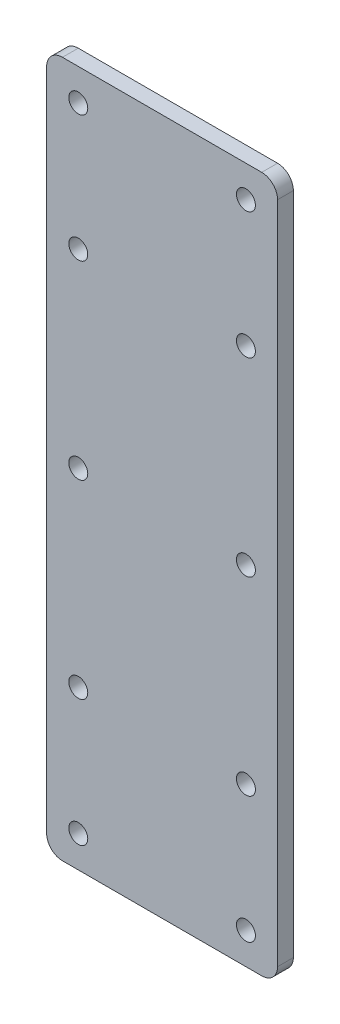
from build123d import *

# Parameters (mm, degrees)
SKETCH2_R           = 3
BOSS_EXTRUDE1_DEPTH = 5


with BuildPart() as part:
    # Sketch2 → Boss-Extrude1 (new body)
    with BuildSketch(Plane.XY):
        with BuildLine():
            Line((5, 0), (68, 0))
            ThreePointArc((68, 0), (71.535533906, 1.464466094), (73, 5))
            Line((73, 5), (73, 215))
            ThreePointArc((73, 215), (71.535533906, 218.535533906), (68, 220))
            Line((68, 220), (5, 220))
            ThreePointArc((5, 220), (1.464466094, 218.535533906), (0, 215))
            Line((0, 215), (0, 5))
            ThreePointArc((0, 5), (1.464466094, 1.464466094), (5, 0))
        make_face()
        with Locations((10, 210)):
            Circle(SKETCH2_R, mode=Mode.SUBTRACT)
        with Locations((63, 210)):
            Circle(SKETCH2_R, mode=Mode.SUBTRACT)
        with Locations((63, 170)):
            Circle(SKETCH2_R, mode=Mode.SUBTRACT)
        with Locations((10, 170)):
            Circle(SKETCH2_R, mode=Mode.SUBTRACT)
        with Locations((63, 50)):
            Circle(SKETCH2_R, mode=Mode.SUBTRACT)
        with Locations((10, 50)):
            Circle(SKETCH2_R, mode=Mode.SUBTRACT)
        with Locations((10, 10)):
            Circle(SKETCH2_R, mode=Mode.SUBTRACT)
        with Locations((63, 10)):
            Circle(SKETCH2_R, mode=Mode.SUBTRACT)
        with Locations((10, 110)):
            Circle(SKETCH2_R, mode=Mode.SUBTRACT)
        with Locations((63, 110)):
            Circle(SKETCH2_R, mode=Mode.SUBTRACT)
    extrude(amount=BOSS_EXTRUDE1_DEPTH)


solid = part.part
